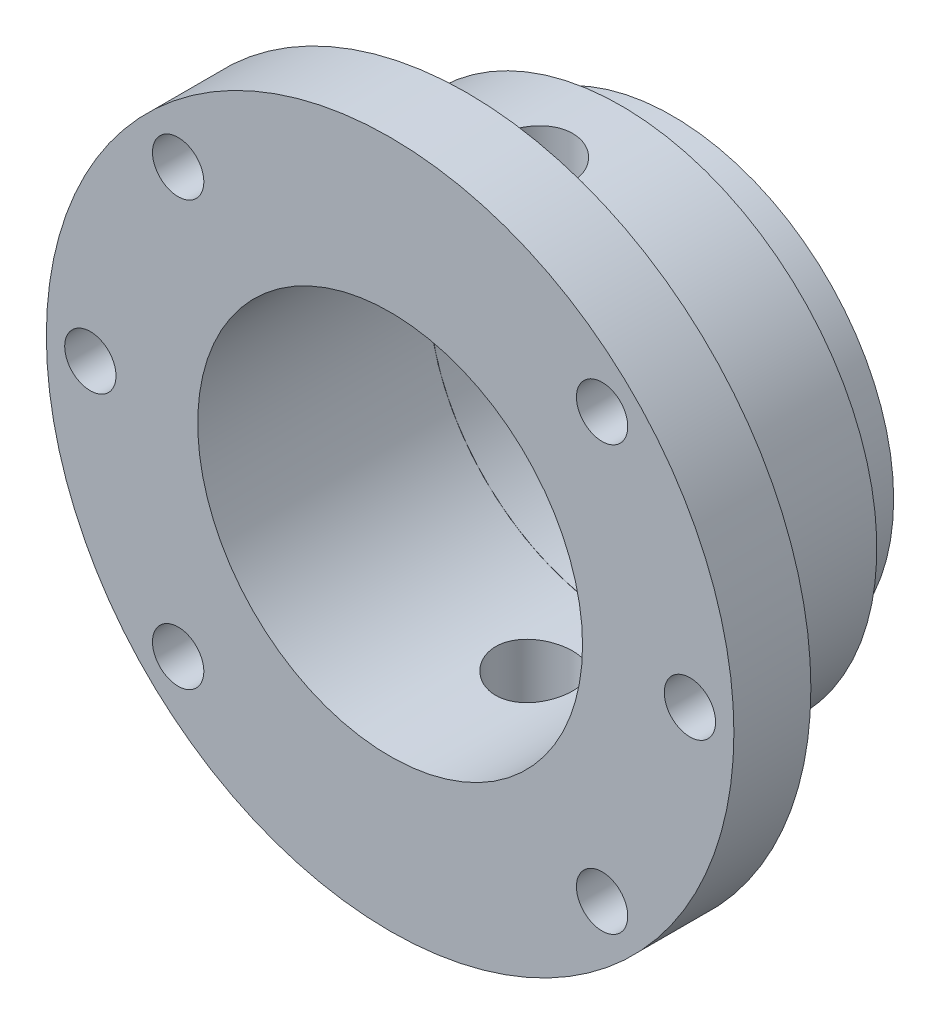
from build123d import *

# Parameters (mm, degrees)
SKETCH_1_R          = 26.8
SKETCH_1_R_2        = 15
EXTRUDE_1_DEPTH     = 18
SKETCH_2_R          = 17.253
SKETCH_2_R_2        = 14.981500248
EXTRUDE_2_DEPTH     = 4
SKETCH_3_R          = 26.8
SKETCH_3_R_2        = 19.94
CUT_EXTRUDE_3_DEPTH = 12
SKETCH_5_R          = 2
CUT_EXTRUDE_4_DEPTH = 42.139761788
SKETCH_7_R          = 3
CUT_EXTRUDE_8_DEPTH = 100


with BuildPart() as part:
    # Эскиз1 → Вытянуть1 (new body)
    with BuildSketch(Plane.XY):
        Circle(SKETCH_1_R)
        Circle(SKETCH_1_R_2, mode=Mode.SUBTRACT)
    extrude(amount=EXTRUDE_1_DEPTH)

    # Эскиз2 → Вытянуть2 (add)
    with BuildSketch(Plane(origin=(0, 0, 0), x_dir=(-1, 0, 0), z_dir=(0, 0, -1))):
        with Locations(Location((0, 0, 0), (0, 0, 180))):
            Circle(SKETCH_2_R)
        Circle(SKETCH_2_R_2, mode=Mode.SUBTRACT)
    extrude(amount=EXTRUDE_2_DEPTH)

    # Эскиз3 → Вытянуть3 (cut)
    with BuildSketch(Plane(origin=(0, 0, 0), x_dir=(-1, 0, 0), z_dir=(0, 0, -1))):
        Circle(SKETCH_3_R)
        Circle(SKETCH_3_R_2, mode=Mode.SUBTRACT)
    extrude(amount=-CUT_EXTRUDE_3_DEPTH, mode=Mode.SUBTRACT)

    # Эскиз5 → Вытянуть4 (cut, through all)
    with BuildSketch(Plane(origin=(0, 0, 12), x_dir=(-1, 0, 0), z_dir=(0, 0, -1))):
        with Locations((-23.37, 0)):
            Circle(SKETCH_5_R)
        with Locations((-16.525085476, 16.525085476)):
            Circle(SKETCH_5_R)
        with Locations((16.525085476, 16.525085476)):
            Circle(SKETCH_5_R)
        with Locations((23.37, 0)):
            Circle(SKETCH_5_R)
        with Locations((16.525085476, -16.525085476)):
            Circle(SKETCH_5_R)
        with Locations((-16.525085476, -16.525085476)):
            Circle(SKETCH_5_R)
    extrude(amount=-CUT_EXTRUDE_4_DEPTH, mode=Mode.SUBTRACT)

    # Эскиз7 → Вытянуть8 (cut)
    with BuildSketch(Plane(origin=(0, 29.05014473, 12), x_dir=(1, 0, 0), z_dir=(0, -1, 0))):
        with Locations(Location((0, -5.233499887, 0), (0, 0, 90))):
            Circle(SKETCH_7_R)
    extrude(amount=CUT_EXTRUDE_8_DEPTH, mode=Mode.SUBTRACT)


solid = part.part
